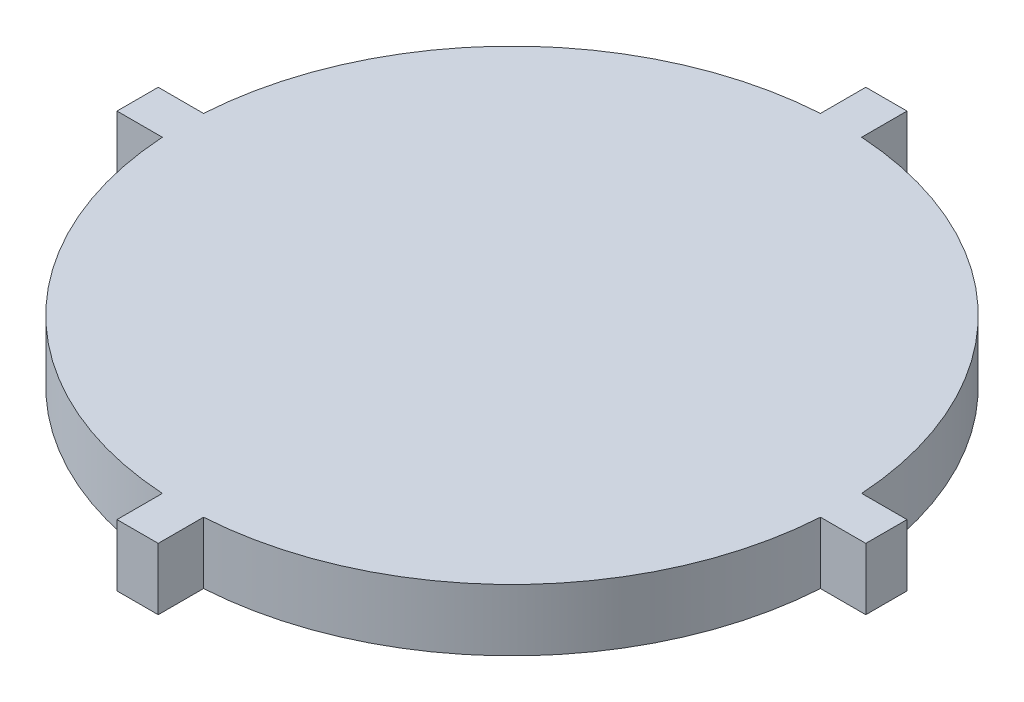
from build123d import *

# Parameters (mm, degrees)
BOSS_EXTRUDE1_DEPTH = 19.05


with BuildPart() as part:
    # Sketch1 → Boss-Extrude1 (new body)
    with BuildSketch(Plane(origin=(0, 0, 0), x_dir=(1, 0, 0), z_dir=(0, 1, 0))):
        with BuildLine():
            Line((-6.35, 115.371368334), (6.35, 115.371368334))
            Line((6.35, 115.371368334), (6.35, 101.401368334))
            ThreePointArc((6.35, 101.401368334), (71.842048969, 71.842048969), (101.401368334, 6.35))
            Line((101.401368334, 6.35), (115.371368334, 6.35))
            Line((115.371368334, 6.35), (115.371368334, -3.175))
            Line((115.371368334, -3.175), (115.371368334, -6.35))
            Line((115.371368334, -6.35), (101.401368334, -6.35))
            ThreePointArc((101.401368334, -6.35), (71.842048969, -71.842048969), (6.35, -101.401368334))
            Line((6.35, -101.401368334), (6.35, -115.371368334))
            Line((6.35, -115.371368334), (-6.35, -115.371368334))
            Line((-6.35, -115.371368334), (-6.35, -101.401368334))
            ThreePointArc((-6.35, -101.401368334), (-71.842048969, -71.842048969), (-101.401368334, -6.35))
            Line((-101.401368334, -6.35), (-115.371368334, -6.35))
            Line((-115.371368334, -6.35), (-115.371368334, 6.35))
            Line((-115.371368334, 6.35), (-101.401368334, 6.35))
            ThreePointArc((-101.401368334, 6.35), (-71.842048969, 71.842048969), (-6.35, 101.401368334))
            Line((-6.35, 101.401368334), (-6.35, 115.371368334))
        make_face()
    extrude(amount=BOSS_EXTRUDE1_DEPTH)


solid = part.part
